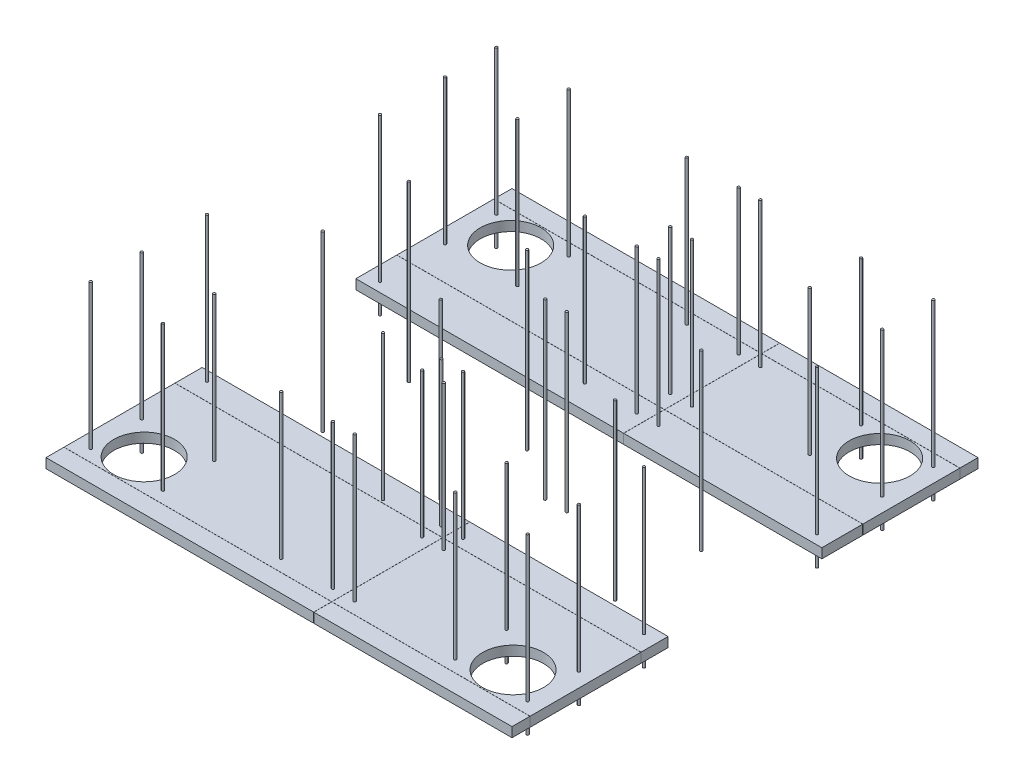
from build123d import *

# Parameters (mm, degrees)
SKETCH1_W                          = 4908.55
SKETCH1_H                          = 4908.55
BOSS_EXTRUDE1_DEPTH                = 101.6
SKETCH2_W                          = 4908.55
SKETCH2_H                          = 1619.25
CUT_EXTRUDE1_DEPTH                 = 3473.355700566
SKETCH4_W                          = 4908.55
SKETCH4_H                          = 1.27
CUT_EXTRUDE_THIN1_DEPTH            = 3473.355700566
CUT_EXTRUDE_THIN2_DEPTH            = 3473.355700566
CUT_EXTRUDE_THIN2_DEPTH_BACK       = 3473.355700566
SKETCH5_W                          = 1.27
SKETCH5_H                          = 4908.55
SKETCH6_R                          = 320.675
DUCT_HOLES_DEPTH                   = 3473.355700566
UNISTRUT_STUD_LAYOUT_DEPTH         = 1524
UNISTRUT_STUD_LAYOUT_DEPTH_BACK    = 304.8
SKETCH7_R                          = 12.7
UNISTRUT_STUD_LAYOUT_2_DEPTH       = 1524
UNISTRUT_STUD_LAYOUT_2_DEPTH_BACK  = 304.8
UNISTRUT_STUD_LAYOUT_3_DEPTH       = 1524
UNISTRUT_STUD_LAYOUT_3_DEPTH_BACK  = 304.8
UNISTRUT_STUD_LAYOUT_4_DEPTH       = 1524
UNISTRUT_STUD_LAYOUT_4_DEPTH_BACK  = 304.8
UNISTRUT_STUD_LAYOUT_5_DEPTH       = 1524
UNISTRUT_STUD_LAYOUT_5_DEPTH_BACK  = 304.8
UNISTRUT_STUD_LAYOUT_6_DEPTH       = 1524
UNISTRUT_STUD_LAYOUT_6_DEPTH_BACK  = 304.8
UNISTRUT_STUD_LAYOUT_7_DEPTH       = 1524
UNISTRUT_STUD_LAYOUT_7_DEPTH_BACK  = 304.8
UNISTRUT_STUD_LAYOUT_8_DEPTH       = 1524
UNISTRUT_STUD_LAYOUT_8_DEPTH_BACK  = 304.8
UNISTRUT_STUD_LAYOUT_9_DEPTH       = 1524
UNISTRUT_STUD_LAYOUT_9_DEPTH_BACK  = 304.8
UNISTRUT_STUD_LAYOUT_10_DEPTH      = 1524
UNISTRUT_STUD_LAYOUT_10_DEPTH_BACK = 304.8
UNISTRUT_STUD_LAYOUT_11_DEPTH      = 1524
UNISTRUT_STUD_LAYOUT_11_DEPTH_BACK = 304.8
UNISTRUT_STUD_LAYOUT_12_DEPTH      = 1524
UNISTRUT_STUD_LAYOUT_12_DEPTH_BACK = 304.8
UNISTRUT_STUD_LAYOUT_13_DEPTH      = 1524
UNISTRUT_STUD_LAYOUT_13_DEPTH_BACK = 304.8
UNISTRUT_STUD_LAYOUT_14_DEPTH      = 1524
UNISTRUT_STUD_LAYOUT_14_DEPTH_BACK = 304.8
UNISTRUT_STUD_LAYOUT_15_DEPTH      = 1524
UNISTRUT_STUD_LAYOUT_15_DEPTH_BACK = 304.8
UNISTRUT_STUD_LAYOUT_16_DEPTH      = 1524
UNISTRUT_STUD_LAYOUT_16_DEPTH_BACK = 304.8
UNISTRUT_STUD_LAYOUT_17_DEPTH      = 1524
UNISTRUT_STUD_LAYOUT_17_DEPTH_BACK = 304.8
UNISTRUT_STUD_LAYOUT_18_DEPTH      = 1524
UNISTRUT_STUD_LAYOUT_18_DEPTH_BACK = 304.8
UNISTRUT_STUD_LAYOUT_19_DEPTH      = 1524
UNISTRUT_STUD_LAYOUT_19_DEPTH_BACK = 304.8
UNISTRUT_STUD_LAYOUT_20_DEPTH      = 1524
UNISTRUT_STUD_LAYOUT_20_DEPTH_BACK = 304.8
UNISTRUT_STUD_LAYOUT_21_DEPTH      = 1524
UNISTRUT_STUD_LAYOUT_21_DEPTH_BACK = 304.8
UNISTRUT_STUD_LAYOUT_22_DEPTH      = 1524
UNISTRUT_STUD_LAYOUT_22_DEPTH_BACK = 304.8
UNISTRUT_STUD_LAYOUT_23_DEPTH      = 1524
UNISTRUT_STUD_LAYOUT_23_DEPTH_BACK = 304.8
UNISTRUT_STUD_LAYOUT_24_DEPTH      = 1524
UNISTRUT_STUD_LAYOUT_24_DEPTH_BACK = 304.8
UNISTRUT_STUD_LAYOUT_25_DEPTH      = 1524
UNISTRUT_STUD_LAYOUT_25_DEPTH_BACK = 304.8
UNISTRUT_STUD_LAYOUT_26_DEPTH      = 1524
UNISTRUT_STUD_LAYOUT_26_DEPTH_BACK = 304.8
UNISTRUT_STUD_LAYOUT_27_DEPTH      = 1524
UNISTRUT_STUD_LAYOUT_27_DEPTH_BACK = 304.8


with BuildPart() as part:
    # Sketch1 → Boss-Extrude1 (new body)
    with BuildSketch(Plane(origin=(0, 0, 0), x_dir=(1, 0, 0), z_dir=(0, 1, 0))):
        Rectangle(SKETCH1_W, SKETCH1_H)
    extrude(amount=BOSS_EXTRUDE1_DEPTH)

    # Sketch2 → Cut-Extrude1 (cut, through all)
    with BuildSketch(Plane(origin=(0, 101.6, 0), x_dir=(1, 0, 0), z_dir=(0, 1, 0))):
        Rectangle(SKETCH2_W, SKETCH2_H)
    extrude(amount=-CUT_EXTRUDE1_DEPTH, mode=Mode.SUBTRACT)


with BuildPart() as cut_extrude1_piece_1:
    # of the separate pieces the step leaves, piece 1, a body of its own (cut_extrude1_pieces)
    add(part.part.solids().sort_by_distance((-2454.275, 0, -2454.275))[0])


with BuildPart() as cut_extrude1_piece_2:
    # of the separate pieces the step leaves, piece 2, a body of its own (cut_extrude1_pieces)
    add(part.part.solids().sort_by_distance((-2454.275, 0, 2454.275))[0])


with BuildPart() as cut_extrude_thin1_tool:
    # Sketch4 → Cut-Extrude-Thin1 (new, through all)
    with BuildSketch(Plane(origin=(0, 101.6, 0), x_dir=(1, 0, 0), z_dir=(0, 1, 0))):
        with Locations((0, -2264.41)):
            Rectangle(SKETCH4_W, SKETCH4_H)
        with Locations((0, -1096.01)):
            Rectangle(SKETCH4_W, SKETCH4_H)
        with Locations((0, 2263.14)):
            Rectangle(SKETCH4_W, SKETCH4_H)
        with Locations((0, 1240.79)):
            Rectangle(SKETCH4_W, SKETCH4_H)
    extrude(amount=-CUT_EXTRUDE_THIN1_DEPTH)


with BuildPart() as cut_extrude1_piece_1_1:
    add(cut_extrude1_piece_1.part)

    # Cut-Extrude-Thin1: cut by cut_extrude_thin1_tool
    add(cut_extrude_thin1_tool.part, mode=Mode.SUBTRACT)


with BuildPart() as cut_extrude1_piece_2_1:
    add(cut_extrude1_piece_2.part)

    # Cut-Extrude-Thin1: cut by cut_extrude_thin1_tool
    add(cut_extrude_thin1_tool.part, mode=Mode.SUBTRACT)


with BuildPart() as cut_extrude_thin1_piece_1:
    # of the separate pieces the step leaves, piece 1, a body of its own (cut_extrude_thin1_pieces)
    add(cut_extrude1_piece_1_1.part.solids().sort_by_distance((-2454.275, 0, -1241.425))[0])


with BuildPart() as cut_extrude_thin1_piece_2:
    # of the separate pieces the step leaves, piece 2, a body of its own (cut_extrude_thin1_pieces)
    add(cut_extrude1_piece_1_1.part.solids().sort_by_distance((-2454.275, 0, -809.625))[0])


with BuildPart() as cut_extrude_thin1_piece_3:
    # of the separate pieces the step leaves, piece 3, a body of its own (cut_extrude_thin1_pieces)
    add(cut_extrude1_piece_1_1.part.solids().sort_by_distance((-2454.275, 0, -2454.275))[0])


with BuildPart() as cut_extrude_thin1_piece_1_of_cut_extrude:
    # of the separate pieces the step leaves, piece 1, a body of its own (cut_extrude_thin1_pieces_of_cut_extrude1)
    add(cut_extrude1_piece_2_1.part.solids().sort_by_distance((-2454.275, 0, 2263.775))[0])


with BuildPart() as cut_extrude_thin1_piece_2_of_cut_extrude:
    # of the separate pieces the step leaves, piece 2, a body of its own (cut_extrude_thin1_pieces_of_cut_extrude1)
    add(cut_extrude1_piece_2_1.part.solids().sort_by_distance((-2454.275, 0, 1095.375))[0])


with BuildPart() as cut_extrude_thin1_piece_3_of_cut_extrude:
    # of the separate pieces the step leaves, piece 3, a body of its own (cut_extrude_thin1_pieces_of_cut_extrude1)
    add(cut_extrude1_piece_2_1.part.solids().sort_by_distance((-2454.275, 0, 2454.275))[0])


with BuildPart() as cut_extrude_thin2_tool:
    # Sketch5 → Cut-Extrude-Thin2 (new, two sides: drawn at the far end of the back side and taken through both)
    with BuildSketch(Plane(origin=(0, 101.6, 0), x_dir=(1, 0, 0), z_dir=(0, 1, 0)).offset(-CUT_EXTRUDE_THIN2_DEPTH_BACK)):
        with Locations((365.76, 0)):
            Rectangle(SKETCH5_W, SKETCH5_H)
    extrude(amount=CUT_EXTRUDE_THIN2_DEPTH + CUT_EXTRUDE_THIN2_DEPTH_BACK)


with BuildPart() as cut_extrude_thin1_piece_1_1:
    add(cut_extrude_thin1_piece_1.part)

    # Cut-Extrude-Thin2: cut by cut_extrude_thin2_tool
    add(cut_extrude_thin2_tool.part, mode=Mode.SUBTRACT)


with BuildPart() as cut_extrude_thin1_piece_2_1:
    add(cut_extrude_thin1_piece_2.part)

    # Cut-Extrude-Thin2: cut by cut_extrude_thin2_tool
    add(cut_extrude_thin2_tool.part, mode=Mode.SUBTRACT)


with BuildPart() as cut_extrude_thin1_piece_3_1:
    add(cut_extrude_thin1_piece_3.part)

    # Cut-Extrude-Thin2: cut by cut_extrude_thin2_tool
    add(cut_extrude_thin2_tool.part, mode=Mode.SUBTRACT)


with BuildPart() as cut_extrude_thin1_piece_1_of_cut_extrude_1:
    add(cut_extrude_thin1_piece_1_of_cut_extrude.part)

    # Cut-Extrude-Thin2: cut by cut_extrude_thin2_tool
    add(cut_extrude_thin2_tool.part, mode=Mode.SUBTRACT)


with BuildPart() as cut_extrude_thin1_piece_2_of_cut_extrude_1:
    add(cut_extrude_thin1_piece_2_of_cut_extrude.part)

    # Cut-Extrude-Thin2: cut by cut_extrude_thin2_tool
    add(cut_extrude_thin2_tool.part, mode=Mode.SUBTRACT)


with BuildPart() as cut_extrude_thin1_piece_3_of_cut_extrude_1:
    add(cut_extrude_thin1_piece_3_of_cut_extrude.part)

    # Cut-Extrude-Thin2: cut by cut_extrude_thin2_tool
    add(cut_extrude_thin2_tool.part, mode=Mode.SUBTRACT)


with BuildPart() as cut_extrude_thin2_piece_1:
    # of the separate pieces the step leaves, piece 1, a body of its own (cut_extrude_thin2_pieces)
    add(cut_extrude_thin1_piece_1_1.part.solids().sort_by_distance((-2454.275, 0, -1241.425))[0])


with BuildPart() as cut_extrude_thin2_piece_2:
    # of the separate pieces the step leaves, piece 2, a body of its own (cut_extrude_thin2_pieces)
    add(cut_extrude_thin1_piece_1_1.part.solids().sort_by_distance((2454.275, 0, -2262.505))[0])


with BuildPart() as cut_extrude_thin2_piece_1_of_cut_extrude:
    # of the separate pieces the step leaves, piece 1, a body of its own (cut_extrude_thin2_pieces_of_cut_extrude)
    add(cut_extrude_thin1_piece_2_1.part.solids().sort_by_distance((-2454.275, 0, -809.625))[0])


with BuildPart() as cut_extrude_thin2_piece_2_of_cut_extrude:
    # of the separate pieces the step leaves, piece 2, a body of its own (cut_extrude_thin2_pieces_of_cut_extrude)
    add(cut_extrude_thin1_piece_2_1.part.solids().sort_by_distance((2454.275, 0, -1240.155))[0])


with BuildPart() as cut_extrude_thin2_piece_1_of_cut_ext_2:
    # of the separate pieces the step leaves, piece 1, a body of its own (cut_extrude_thin2_pieces_of_cut_extr_2)
    add(cut_extrude_thin1_piece_3_1.part.solids().sort_by_distance((-2454.275, 0, -2454.275))[0])


with BuildPart() as cut_extrude_thin2_piece_2_of_cut_ext_2:
    # of the separate pieces the step leaves, piece 2, a body of its own (cut_extrude_thin2_pieces_of_cut_extr_2)
    add(cut_extrude_thin1_piece_3_1.part.solids().sort_by_distance((366.395, 0, -2454.275))[0])


with BuildPart() as cut_extrude_thin2_piece_1_of_cut_ext_3:
    # of the separate pieces the step leaves, piece 1, a body of its own (cut_extrude_thin2_pieces_of_cut_extr_3)
    add(cut_extrude_thin1_piece_1_of_cut_extrude_1.part.solids().sort_by_distance((-2454.275, 0, 2263.775))[0])


with BuildPart() as cut_extrude_thin2_piece_2_of_cut_ext_3:
    # of the separate pieces the step leaves, piece 2, a body of its own (cut_extrude_thin2_pieces_of_cut_extr_3)
    add(cut_extrude_thin1_piece_1_of_cut_extrude_1.part.solids().sort_by_distance((2454.275, 0, 1096.645))[0])


with BuildPart() as cut_extrude_thin2_piece_1_of_cut_ext_4:
    # of the separate pieces the step leaves, piece 1, a body of its own (cut_extrude_thin2_pieces_of_cut_extr_4)
    add(cut_extrude_thin1_piece_2_of_cut_extrude_1.part.solids().sort_by_distance((-2454.275, 0, 1095.375))[0])


with BuildPart() as cut_extrude_thin2_piece_2_of_cut_ext_4:
    # of the separate pieces the step leaves, piece 2, a body of its own (cut_extrude_thin2_pieces_of_cut_extr_4)
    add(cut_extrude_thin1_piece_2_of_cut_extrude_1.part.solids().sort_by_distance((2454.275, 0, 809.625))[0])


with BuildPart() as cut_extrude_thin2_piece_1_of_cut_ext_5:
    # of the separate pieces the step leaves, piece 1, a body of its own (cut_extrude_thin2_pieces_of_cut_extr_5)
    add(cut_extrude_thin1_piece_3_of_cut_extrude_1.part.solids().sort_by_distance((-2454.275, 0, 2454.275))[0])


with BuildPart() as cut_extrude_thin2_piece_2_of_cut_ext_5:
    # of the separate pieces the step leaves, piece 2, a body of its own (cut_extrude_thin2_pieces_of_cut_extr_5)
    add(cut_extrude_thin1_piece_3_of_cut_extrude_1.part.solids().sort_by_distance((2454.275, 0, 2265.045))[0])


with BuildPart() as duct_holes_tool:
    # Sketch6 → DUCT HOLES (new, through all)
    with BuildSketch(Plane(origin=(0, 101.6, 0), x_dir=(1, 0, 0), z_dir=(0, 1, 0))):
        with Locations(Location((1943.1, 1929.13, 0), (0, 0, 270))):
            Circle(SKETCH6_R)
        with Locations(Location((-1943.1, 1929.13, 0), (0, 0, 270))):
            Circle(SKETCH6_R)
        with Locations(Location((-1943.1, -1931.67, 0), (0, 0, 270))):
            Circle(SKETCH6_R)
        with Locations(Location((1943.1, -1931.67, 0), (0, 0, 270))):
            Circle(SKETCH6_R)
    extrude(amount=-DUCT_HOLES_DEPTH)


with BuildPart() as cut_extrude_thin2_piece_1_1:
    add(cut_extrude_thin2_piece_1.part)

    # DUCT HOLES: cut by duct_holes_tool
    add(duct_holes_tool.part, mode=Mode.SUBTRACT)


with BuildPart() as cut_extrude_thin2_piece_2_1:
    add(cut_extrude_thin2_piece_2.part)

    # DUCT HOLES: cut by duct_holes_tool
    add(duct_holes_tool.part, mode=Mode.SUBTRACT)


with BuildPart() as cut_extrude_thin2_piece_1_of_cut_ext_3_1:
    add(cut_extrude_thin2_piece_1_of_cut_ext_3.part)

    # DUCT HOLES: cut by duct_holes_tool
    add(duct_holes_tool.part, mode=Mode.SUBTRACT)


with BuildPart() as cut_extrude_thin2_piece_2_of_cut_ext_3_1:
    add(cut_extrude_thin2_piece_2_of_cut_ext_3.part)

    # DUCT HOLES: cut by duct_holes_tool
    add(duct_holes_tool.part, mode=Mode.SUBTRACT)


with BuildPart() as body_13:
    # Sketch7 → UNISTRUT STUD LAYOUT (new, two sides: drawn at the far end of the back side and taken through both)
    with BuildSketch(Plane(origin=(0, 101.6, 0), x_dir=(1, 0, 0), z_dir=(0, 1, 0)).offset(-UNISTRUT_STUD_LAYOUT_DEPTH_BACK)):
        with Locations(Location((1539.875, 1597.025, 0), (0, 0, 270))):
            Circle(SKETCH7_R)
    extrude(amount=UNISTRUT_STUD_LAYOUT_DEPTH + UNISTRUT_STUD_LAYOUT_DEPTH_BACK)


with BuildPart() as body_14:
    # Sketch7 → UNISTRUT STUD LAYOUT 2 (new, two sides: drawn at the far end of the back side and taken through both)
    with BuildSketch(Plane(origin=(0, 101.6, 0), x_dir=(1, 0, 0), z_dir=(0, 1, 0)).offset(-UNISTRUT_STUD_LAYOUT_2_DEPTH_BACK)):
        with Locations(Location((-1539.875, 1597.025, 0), (0, 0, 270))):
            Circle(SKETCH7_R)
    extrude(amount=UNISTRUT_STUD_LAYOUT_2_DEPTH + UNISTRUT_STUD_LAYOUT_2_DEPTH_BACK)


with BuildPart() as body_15:
    # Sketch7 → UNISTRUT STUD LAYOUT 3 (new, two sides: drawn at the far end of the back side and taken through both)
    with BuildSketch(Plane(origin=(0, 101.6, 0), x_dir=(1, 0, 0), z_dir=(0, 1, 0)).offset(-UNISTRUT_STUD_LAYOUT_3_DEPTH_BACK)):
        with Locations(Location((479.425, 1063.625, 0), (0, 0, 270))):
            Circle(SKETCH7_R)
    extrude(amount=UNISTRUT_STUD_LAYOUT_3_DEPTH + UNISTRUT_STUD_LAYOUT_3_DEPTH_BACK)


with BuildPart() as body_16:
    # Sketch7 → UNISTRUT STUD LAYOUT 4 (new, two sides: drawn at the far end of the back side and taken through both)
    with BuildSketch(Plane(origin=(0, 101.6, 0), x_dir=(1, 0, 0), z_dir=(0, 1, 0)).offset(-UNISTRUT_STUD_LAYOUT_4_DEPTH_BACK)):
        with Locations(Location((-295.275, 2136.775, 0), (0, 0, 270))):
            Circle(SKETCH7_R)
    extrude(amount=UNISTRUT_STUD_LAYOUT_4_DEPTH + UNISTRUT_STUD_LAYOUT_4_DEPTH_BACK)


with BuildPart() as body_17:
    # Sketch7 → UNISTRUT STUD LAYOUT 5 (new, two sides: drawn at the far end of the back side and taken through both)
    with BuildSketch(Plane(origin=(0, 101.6, 0), x_dir=(1, 0, 0), z_dir=(0, 1, 0)).offset(-UNISTRUT_STUD_LAYOUT_5_DEPTH_BACK)):
        with Locations(Location((-1539.875, 2136.775, 0), (0, 0, 270))):
            Circle(SKETCH7_R)
    extrude(amount=UNISTRUT_STUD_LAYOUT_5_DEPTH + UNISTRUT_STUD_LAYOUT_5_DEPTH_BACK)


with BuildPart() as body_18:
    # Sketch7 → UNISTRUT STUD LAYOUT 6 (new, two sides: drawn at the far end of the back side and taken through both)
    with BuildSketch(Plane(origin=(0, 101.6, 0), x_dir=(1, 0, 0), z_dir=(0, 1, 0)).offset(-UNISTRUT_STUD_LAYOUT_6_DEPTH_BACK)):
        with Locations(Location((1539.875, 2136.775, 0), (0, 0, 270))):
            Circle(SKETCH7_R)
    extrude(amount=UNISTRUT_STUD_LAYOUT_6_DEPTH + UNISTRUT_STUD_LAYOUT_6_DEPTH_BACK)


with BuildPart() as body_19:
    # Sketch7 → UNISTRUT STUD LAYOUT 7 (new, two sides: drawn at the far end of the back side and taken through both)
    with BuildSketch(Plane(origin=(0, 101.6, 0), x_dir=(1, 0, 0), z_dir=(0, 1, 0)).offset(-UNISTRUT_STUD_LAYOUT_7_DEPTH_BACK)):
        with Locations(Location((-295.275, 1063.625, 0), (0, 0, 270))):
            Circle(SKETCH7_R)
    extrude(amount=UNISTRUT_STUD_LAYOUT_7_DEPTH + UNISTRUT_STUD_LAYOUT_7_DEPTH_BACK)


with BuildPart() as body_20:
    # Sketch7 → UNISTRUT STUD LAYOUT 8 (new, two sides: drawn at the far end of the back side and taken through both)
    with BuildSketch(Plane(origin=(0, 101.6, 0), x_dir=(1, 0, 0), z_dir=(0, 1, 0)).offset(-UNISTRUT_STUD_LAYOUT_8_DEPTH_BACK)):
        with Locations(Location((-2301.875, 1597.025, 0), (0, 0, 270))):
            Circle(SKETCH7_R)
    extrude(amount=UNISTRUT_STUD_LAYOUT_8_DEPTH + UNISTRUT_STUD_LAYOUT_8_DEPTH_BACK)


with BuildPart() as body_21:
    # Sketch7 → UNISTRUT STUD LAYOUT 9 (new, two sides: drawn at the far end of the back side and taken through both)
    with BuildSketch(Plane(origin=(0, 101.6, 0), x_dir=(1, 0, 0), z_dir=(0, 1, 0)).offset(-UNISTRUT_STUD_LAYOUT_9_DEPTH_BACK)):
        with Locations(Location((2301.875, 1597.025, 0), (0, 0, 270))):
            Circle(SKETCH7_R)
    extrude(amount=UNISTRUT_STUD_LAYOUT_9_DEPTH + UNISTRUT_STUD_LAYOUT_9_DEPTH_BACK)


with BuildPart() as body_22:
    # Sketch7 → UNISTRUT STUD LAYOUT 10 (new, two sides: drawn at the far end of the back side and taken through both)
    with BuildSketch(Plane(origin=(0, 101.6, 0), x_dir=(1, 0, 0), z_dir=(0, 1, 0)).offset(-UNISTRUT_STUD_LAYOUT_10_DEPTH_BACK)):
        with Locations(Location((-2301.875, 2136.775, 0), (0, 0, 270))):
            Circle(SKETCH7_R)
    extrude(amount=UNISTRUT_STUD_LAYOUT_10_DEPTH + UNISTRUT_STUD_LAYOUT_10_DEPTH_BACK)


with BuildPart() as body_23:
    # Sketch7 → UNISTRUT STUD LAYOUT 11 (new, two sides: drawn at the far end of the back side and taken through both)
    with BuildSketch(Plane(origin=(0, 101.6, 0), x_dir=(1, 0, 0), z_dir=(0, 1, 0)).offset(-UNISTRUT_STUD_LAYOUT_11_DEPTH_BACK)):
        with Locations(Location((2301.875, 2136.775, 0), (0, 0, 270))):
            Circle(SKETCH7_R)
    extrude(amount=UNISTRUT_STUD_LAYOUT_11_DEPTH + UNISTRUT_STUD_LAYOUT_11_DEPTH_BACK)


with BuildPart() as body_24:
    # Sketch7 → UNISTRUT STUD LAYOUT 12 (new, two sides: drawn at the far end of the back side and taken through both)
    with BuildSketch(Plane(origin=(0, 101.6, 0), x_dir=(1, 0, 0), z_dir=(0, 1, 0)).offset(-UNISTRUT_STUD_LAYOUT_12_DEPTH_BACK)):
        with Locations(Location((250.825, 1416.685, 0), (0, 0, 270))):
            Circle(SKETCH7_R)
    extrude(amount=UNISTRUT_STUD_LAYOUT_12_DEPTH + UNISTRUT_STUD_LAYOUT_12_DEPTH_BACK)


with BuildPart() as body_25:
    # Sketch7 → UNISTRUT STUD LAYOUT 13 (new, two sides: drawn at the far end of the back side and taken through both)
    with BuildSketch(Plane(origin=(0, 101.6, 0), x_dir=(1, 0, 0), z_dir=(0, 1, 0)).offset(-UNISTRUT_STUD_LAYOUT_13_DEPTH_BACK)):
        with Locations(Location((479.425, 1416.685, 0), (0, 0, 270))):
            Circle(SKETCH7_R)
    extrude(amount=UNISTRUT_STUD_LAYOUT_13_DEPTH + UNISTRUT_STUD_LAYOUT_13_DEPTH_BACK)


with BuildPart() as body_26:
    # Sketch7 → UNISTRUT STUD LAYOUT 14 (new, two sides: drawn at the far end of the back side and taken through both)
    with BuildSketch(Plane(origin=(0, 101.6, 0), x_dir=(1, 0, 0), z_dir=(0, 1, 0)).offset(-UNISTRUT_STUD_LAYOUT_14_DEPTH_BACK)):
        with Locations(Location((250.825, 1063.625, 0), (0, 0, 270))):
            Circle(SKETCH7_R)
    extrude(amount=UNISTRUT_STUD_LAYOUT_14_DEPTH + UNISTRUT_STUD_LAYOUT_14_DEPTH_BACK)


with BuildPart() as body_27:
    # Sketch7 → UNISTRUT STUD LAYOUT 15 (new, two sides: drawn at the far end of the back side and taken through both)
    with BuildSketch(Plane(origin=(0, 101.6, 0), x_dir=(1, 0, 0), z_dir=(0, 1, 0)).offset(-UNISTRUT_STUD_LAYOUT_15_DEPTH_BACK)):
        with Locations(Location((479.425, -995.045, 0), (0, 0, 270))):
            Circle(SKETCH7_R)
    extrude(amount=UNISTRUT_STUD_LAYOUT_15_DEPTH + UNISTRUT_STUD_LAYOUT_15_DEPTH_BACK)


with BuildPart() as body_28:
    # Sketch7 → UNISTRUT STUD LAYOUT 16 (new, two sides: drawn at the far end of the back side and taken through both)
    with BuildSketch(Plane(origin=(0, 101.6, 0), x_dir=(1, 0, 0), z_dir=(0, 1, 0)).offset(-UNISTRUT_STUD_LAYOUT_16_DEPTH_BACK)):
        with Locations(Location((250.825, -995.045, 0), (0, 0, 270))):
            Circle(SKETCH7_R)
    extrude(amount=UNISTRUT_STUD_LAYOUT_16_DEPTH + UNISTRUT_STUD_LAYOUT_16_DEPTH_BACK)


with BuildPart() as body_29:
    # Sketch7 → UNISTRUT STUD LAYOUT 17 (new, two sides: drawn at the far end of the back side and taken through both)
    with BuildSketch(Plane(origin=(0, 101.6, 0), x_dir=(1, 0, 0), z_dir=(0, 1, 0)).offset(-UNISTRUT_STUD_LAYOUT_17_DEPTH_BACK)):
        with Locations(Location((250.825, -1198.245, 0), (0, 0, 270))):
            Circle(SKETCH7_R)
    extrude(amount=UNISTRUT_STUD_LAYOUT_17_DEPTH + UNISTRUT_STUD_LAYOUT_17_DEPTH_BACK)


with BuildPart() as body_30:
    # Sketch7 → UNISTRUT STUD LAYOUT 18 (new, two sides: drawn at the far end of the back side and taken through both)
    with BuildSketch(Plane(origin=(0, 101.6, 0), x_dir=(1, 0, 0), z_dir=(0, 1, 0)).offset(-UNISTRUT_STUD_LAYOUT_18_DEPTH_BACK)):
        with Locations(Location((479.425, -1198.245, 0), (0, 0, 270))):
            Circle(SKETCH7_R)
    extrude(amount=UNISTRUT_STUD_LAYOUT_18_DEPTH + UNISTRUT_STUD_LAYOUT_18_DEPTH_BACK)


with BuildPart() as body_31:
    # Sketch7 → UNISTRUT STUD LAYOUT 19 (new, two sides: drawn at the far end of the back side and taken through both)
    with BuildSketch(Plane(origin=(0, 101.6, 0), x_dir=(1, 0, 0), z_dir=(0, 1, 0)).offset(-UNISTRUT_STUD_LAYOUT_19_DEPTH_BACK)):
        with Locations(Location((-2301.875, 911.225, 0), (0, 0, 270))):
            Circle(SKETCH7_R)
    extrude(amount=UNISTRUT_STUD_LAYOUT_19_DEPTH + UNISTRUT_STUD_LAYOUT_19_DEPTH_BACK)


with BuildPart() as body_32:
    # Sketch7 → UNISTRUT STUD LAYOUT 20 (new, two sides: drawn at the far end of the back side and taken through both)
    with BuildSketch(Plane(origin=(0, 101.6, 0), x_dir=(1, 0, 0), z_dir=(0, 1, 0)).offset(-UNISTRUT_STUD_LAYOUT_20_DEPTH_BACK)):
        with Locations(Location((2301.875, 911.225, 0), (0, 0, 270))):
            Circle(SKETCH7_R)
    extrude(amount=UNISTRUT_STUD_LAYOUT_20_DEPTH + UNISTRUT_STUD_LAYOUT_20_DEPTH_BACK)


with BuildPart() as body_33:
    # Sketch7 → UNISTRUT STUD LAYOUT 21 (new, two sides: drawn at the far end of the back side and taken through both)
    with BuildSketch(Plane(origin=(0, 101.6, 0), x_dir=(1, 0, 0), z_dir=(0, 1, 0)).offset(-UNISTRUT_STUD_LAYOUT_21_DEPTH_BACK)):
        with Locations(Location((1539.875, 454.025, 0), (0, 0, 270))):
            Circle(SKETCH7_R)
    extrude(amount=UNISTRUT_STUD_LAYOUT_21_DEPTH + UNISTRUT_STUD_LAYOUT_21_DEPTH_BACK)


with BuildPart() as body_34:
    # Sketch7 → UNISTRUT STUD LAYOUT 22 (new, two sides: drawn at the far end of the back side and taken through both)
    with BuildSketch(Plane(origin=(0, 101.6, 0), x_dir=(1, 0, 0), z_dir=(0, 1, 0)).offset(-UNISTRUT_STUD_LAYOUT_22_DEPTH_BACK)):
        with Locations(Location((-1539.875, 454.025, 0), (0, 0, 270))):
            Circle(SKETCH7_R)
    extrude(amount=UNISTRUT_STUD_LAYOUT_22_DEPTH + UNISTRUT_STUD_LAYOUT_22_DEPTH_BACK)


with BuildPart() as body_35:
    # Sketch7 → UNISTRUT STUD LAYOUT 23 (new, two sides: drawn at the far end of the back side and taken through both)
    with BuildSketch(Plane(origin=(0, 101.6, 0), x_dir=(1, 0, 0), z_dir=(0, 1, 0)).offset(-UNISTRUT_STUD_LAYOUT_23_DEPTH_BACK)):
        with Locations(Location((-295.275, 454.025, 0), (0, 0, 270))):
            Circle(SKETCH7_R)
    extrude(amount=UNISTRUT_STUD_LAYOUT_23_DEPTH + UNISTRUT_STUD_LAYOUT_23_DEPTH_BACK)


with BuildPart() as body_36:
    # Sketch7 → UNISTRUT STUD LAYOUT 24 (new, two sides: drawn at the far end of the back side and taken through both)
    with BuildSketch(Plane(origin=(0, 101.6, 0), x_dir=(1, 0, 0), z_dir=(0, 1, 0)).offset(-UNISTRUT_STUD_LAYOUT_24_DEPTH_BACK)):
        with Locations(Location((479.425, 98.425, 0), (0, 0, 270))):
            Circle(SKETCH7_R)
    extrude(amount=UNISTRUT_STUD_LAYOUT_24_DEPTH + UNISTRUT_STUD_LAYOUT_24_DEPTH_BACK)


with BuildPart() as body_37:
    # Sketch7 → UNISTRUT STUD LAYOUT 25 (new, two sides: drawn at the far end of the back side and taken through both)
    with BuildSketch(Plane(origin=(0, 101.6, 0), x_dir=(1, 0, 0), z_dir=(0, 1, 0)).offset(-UNISTRUT_STUD_LAYOUT_25_DEPTH_BACK)):
        with Locations(Location((250.825, 98.425, 0), (0, 0, 270))):
            Circle(SKETCH7_R)
    extrude(amount=UNISTRUT_STUD_LAYOUT_25_DEPTH + UNISTRUT_STUD_LAYOUT_25_DEPTH_BACK)


with BuildPart() as body_38:
    # Sketch7 → UNISTRUT STUD LAYOUT 26 (new, two sides: drawn at the far end of the back side and taken through both)
    with BuildSketch(Plane(origin=(0, 101.6, 0), x_dir=(1, 0, 0), z_dir=(0, 1, 0)).offset(-UNISTRUT_STUD_LAYOUT_26_DEPTH_BACK)):
        with Locations(Location((250.825, 2136.775, 0), (0, 0, 270))):
            Circle(SKETCH7_R)
    extrude(amount=UNISTRUT_STUD_LAYOUT_26_DEPTH + UNISTRUT_STUD_LAYOUT_26_DEPTH_BACK)


with BuildPart() as body_39:
    # Sketch7 → UNISTRUT STUD LAYOUT 27 (new, two sides: drawn at the far end of the back side and taken through both)
    with BuildSketch(Plane(origin=(0, 101.6, 0), x_dir=(1, 0, 0), z_dir=(0, 1, 0)).offset(-UNISTRUT_STUD_LAYOUT_27_DEPTH_BACK)):
        with Locations(Location((479.425, 2136.775, 0), (0, 0, 270))):
            Circle(SKETCH7_R)
    extrude(amount=UNISTRUT_STUD_LAYOUT_27_DEPTH + UNISTRUT_STUD_LAYOUT_27_DEPTH_BACK)


with BuildPart() as body_40:
    # Mirror3: mirrored copy
    add(body_20.part.mirror(Plane.XY))


with BuildPart() as body_41:
    # Mirror3 2: mirrored copy
    add(body_14.part.mirror(Plane.XY))


with BuildPart() as body_42:
    # Mirror3 3: mirrored copy
    add(body_17.part.mirror(Plane.XY))


with BuildPart() as body_43:
    # Mirror3 4: mirrored copy
    add(body_19.part.mirror(Plane.XY))


with BuildPart() as body_44:
    # Mirror3 5: mirrored copy
    add(body_16.part.mirror(Plane.XY))


with BuildPart() as body_45:
    # Mirror3 6: mirrored copy
    add(body_13.part.mirror(Plane.XY))


with BuildPart() as body_46:
    # Mirror3 7: mirrored copy
    add(body_18.part.mirror(Plane.XY))


with BuildPart() as body_47:
    # Mirror3 8: mirrored copy
    add(body_21.part.mirror(Plane.XY))


with BuildPart() as body_48:
    # Mirror3 9: mirrored copy
    add(body_22.part.mirror(Plane.XY))


with BuildPart() as body_49:
    # Mirror3 10: mirrored copy
    add(body_23.part.mirror(Plane.XY))


with BuildPart() as body_50:
    # Mirror3 11: mirrored copy
    add(body_32.part.mirror(Plane.XY))


with BuildPart() as body_51:
    # Mirror3 12: mirrored copy
    add(body_31.part.mirror(Plane.XY))


with BuildPart() as body_52:
    # Mirror3 13: mirrored copy
    add(body_34.part.mirror(Plane.XY))


with BuildPart() as body_53:
    # Mirror3 14: mirrored copy
    add(body_35.part.mirror(Plane.XY))


with BuildPart() as body_54:
    # Mirror3 15: mirrored copy
    add(body_33.part.mirror(Plane.XY))


with BuildPart() as body_55:
    # Mirror3 16: mirrored copy
    add(body_38.part.mirror(Plane.XY))


with BuildPart() as body_56:
    # Mirror3 17: mirrored copy
    add(body_39.part.mirror(Plane.XY))


solid = Compound([cut_extrude_thin2_piece_1_of_cut_extrude.part, cut_extrude_thin2_piece_2_of_cut_extrude.part, cut_extrude_thin2_piece_1_of_cut_ext_2.part, cut_extrude_thin2_piece_2_of_cut_ext_2.part, cut_extrude_thin2_piece_1_of_cut_ext_4.part, cut_extrude_thin2_piece_2_of_cut_ext_4.part, cut_extrude_thin2_piece_1_of_cut_ext_5.part, cut_extrude_thin2_piece_2_of_cut_ext_5.part, cut_extrude_thin2_piece_1_1.part, cut_extrude_thin2_piece_2_1.part, cut_extrude_thin2_piece_1_of_cut_ext_3_1.part, cut_extrude_thin2_piece_2_of_cut_ext_3_1.part, body_13.part, body_14.part, body_15.part, body_16.part, body_17.part, body_18.part, body_19.part, body_20.part, body_21.part, body_22.part, body_23.part, body_24.part, body_25.part, body_26.part, body_27.part, body_28.part, body_29.part, body_30.part, body_31.part, body_32.part, body_33.part, body_34.part, body_35.part, body_36.part, body_37.part, body_38.part, body_39.part, body_40.part, body_41.part, body_42.part, body_43.part, body_44.part, body_45.part, body_46.part, body_47.part, body_48.part, body_49.part, body_50.part, body_51.part, body_52.part, body_53.part, body_54.part, body_55.part, body_56.part])
